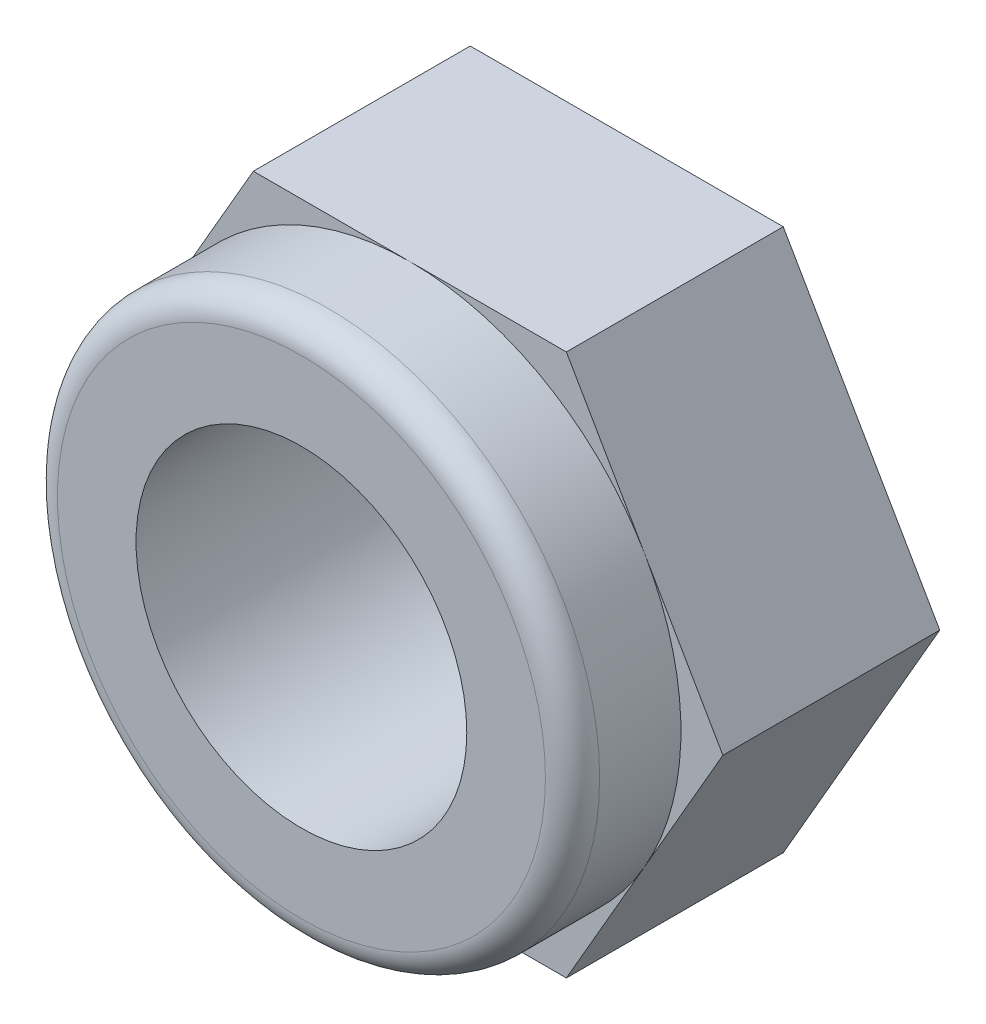
from build123d import *

# Parameters (mm, degrees)
SKETCH1_R           = 3.05
BOSS_EXTRUDE1_DEPTH = 4
SKETCH2_R           = 5
SKETCH2_R_2         = 3.05
BOSS_EXTRUDE2_DEPTH = 2
FILLET1_R           = 0.5


with BuildPart() as part:
    # Sketch1 → Boss-Extrude1 (new body)
    with BuildSketch(Plane.XY):
        Polygon((-2.886751346, -0.1), (-5.773502692, -5.1), (-2.886751346, -10.1), (2.886751346, -10.1), (5.773502692, -5.1), (2.886751346, -0.1), align=None)
        with Locations((0, -5.1)):
            Circle(SKETCH1_R, mode=Mode.SUBTRACT)
    extrude(amount=BOSS_EXTRUDE1_DEPTH)

    # Sketch2 → Boss-Extrude2 (add)
    with BuildSketch(Plane.XY.offset(4)):
        with Locations(Location((0, -5.1, 0), (0, 0, 150))):
            Circle(SKETCH2_R)
        with Locations((0, -5.1)):
            Circle(SKETCH2_R_2, mode=Mode.SUBTRACT)
    extrude(amount=BOSS_EXTRUDE2_DEPTH)

    # Fillet1
    fillet1_edges = [part.edges().sort_by_distance(p)[0] for p in [
        (4.330127019, -7.6, 6),
    ]]
    fillet(fillet1_edges, radius=FILLET1_R)


solid = part.part
